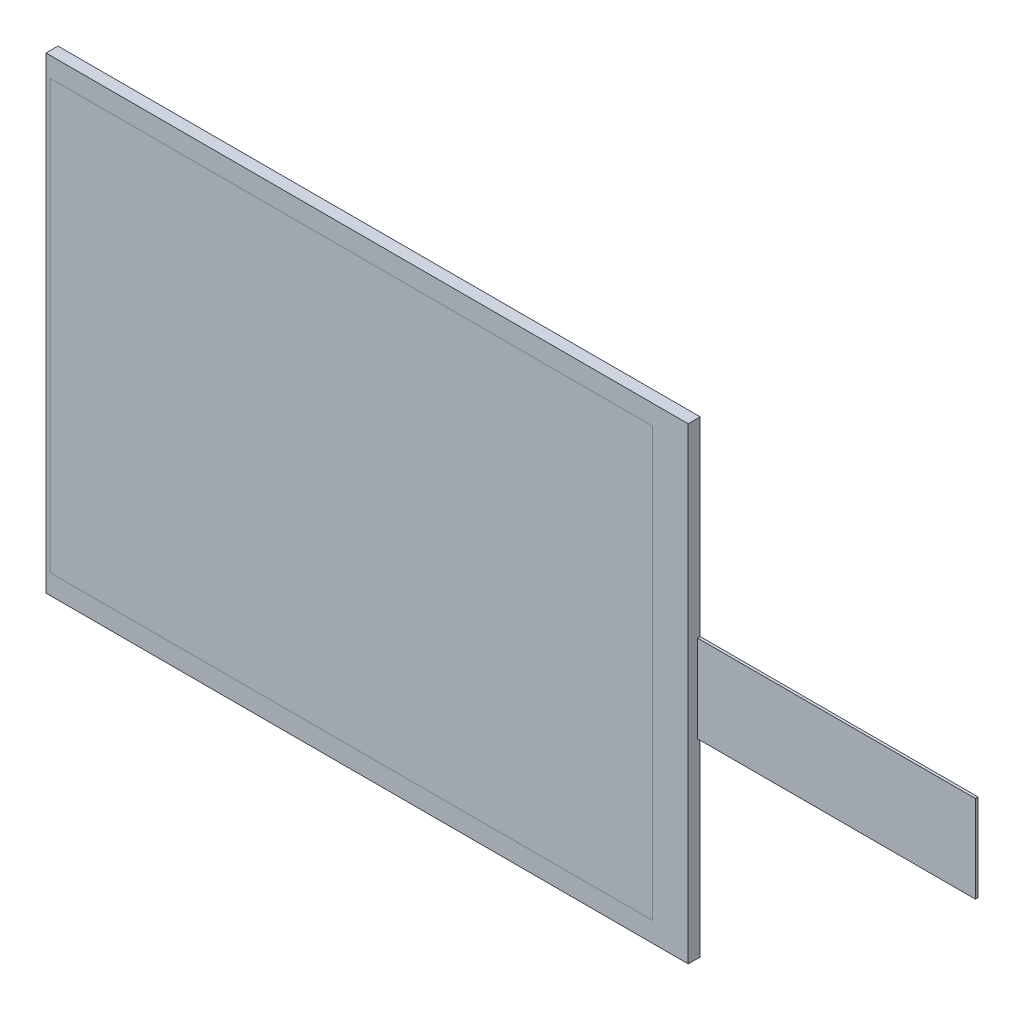
from build123d import *

# Parameters (mm, degrees)
SKETCH1_W           = 45.6
SKETCH1_H           = 32.4
BOSS_EXTRUDE1_DEPTH = 0.91
SKETCH1_3_W         = 45.6
SKETCH1_3_H         = 32.4
BOSS_EXTRUDE2_DEPTH = 0.91
SKETCH1_4_W         = 21.02
SKETCH1_4_H         = 6.6
BOSS_EXTRUDE3_DEPTH = 0.2


with BuildPart() as part:
    # Sketch1 → Boss-Extrude1 (new body)
    with BuildSketch(Plane.XY):
        Rectangle(SKETCH1_W, SKETCH1_H)
    extrude(amount=BOSS_EXTRUDE1_DEPTH)


with BuildPart() as body_2:
    # Sketch1<3> → Boss-Extrude2 (new body)
    with BuildSketch(Plane.XY):
        Polygon((25.5, 3.3), (25.5, 17.7), (-23.1, 17.7), (-23.1, -17.7), (25.5, -17.7), (25.5, -3.3), align=None)
        Rectangle(SKETCH1_3_W, SKETCH1_3_H, mode=Mode.SUBTRACT)
    extrude(amount=BOSS_EXTRUDE2_DEPTH)


with BuildPart() as body_3:
    # Sketch1<4> → Boss-Extrude3 (new body)
    with BuildSketch(Plane.XY):
        with Locations((36.01, 0)):
            Rectangle(SKETCH1_4_W, SKETCH1_4_H)
    extrude(amount=BOSS_EXTRUDE3_DEPTH)


solid = Compound([part.part, body_2.part, body_3.part])
